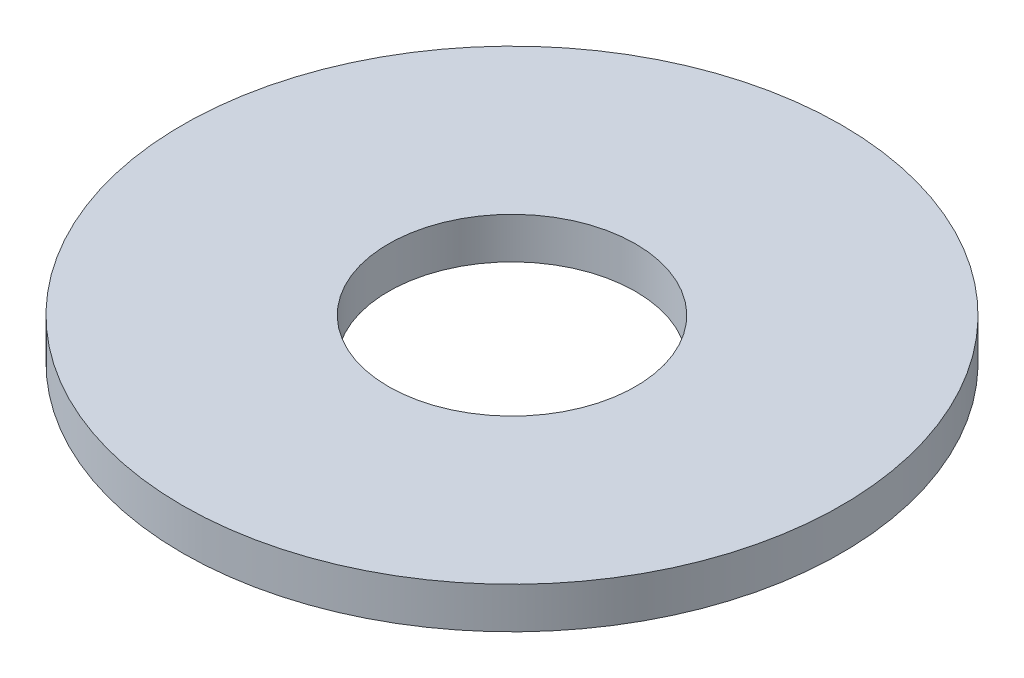
from build123d import *

# Parameters (mm, degrees)
SKETCH_1_R      = 4
SKETCH_1_R_2    = 1.5
EXTRUDE_1_DEPTH = 0.5


with BuildPart() as part:
    # 草图1 → 凸台-拉伸1 (new body)
    with BuildSketch(Plane(origin=(0, 0, 0), x_dir=(1, 0, 0), z_dir=(0, 1, 0))):
        with Locations(Location((0, 0, 0), (0, 0, 270))):
            Circle(SKETCH_1_R)
        with Locations(Location((0, 0, 0), (0, 0, 270))):
            Circle(SKETCH_1_R_2, mode=Mode.SUBTRACT)
    extrude(amount=EXTRUDE_1_DEPTH)


solid = part.part
